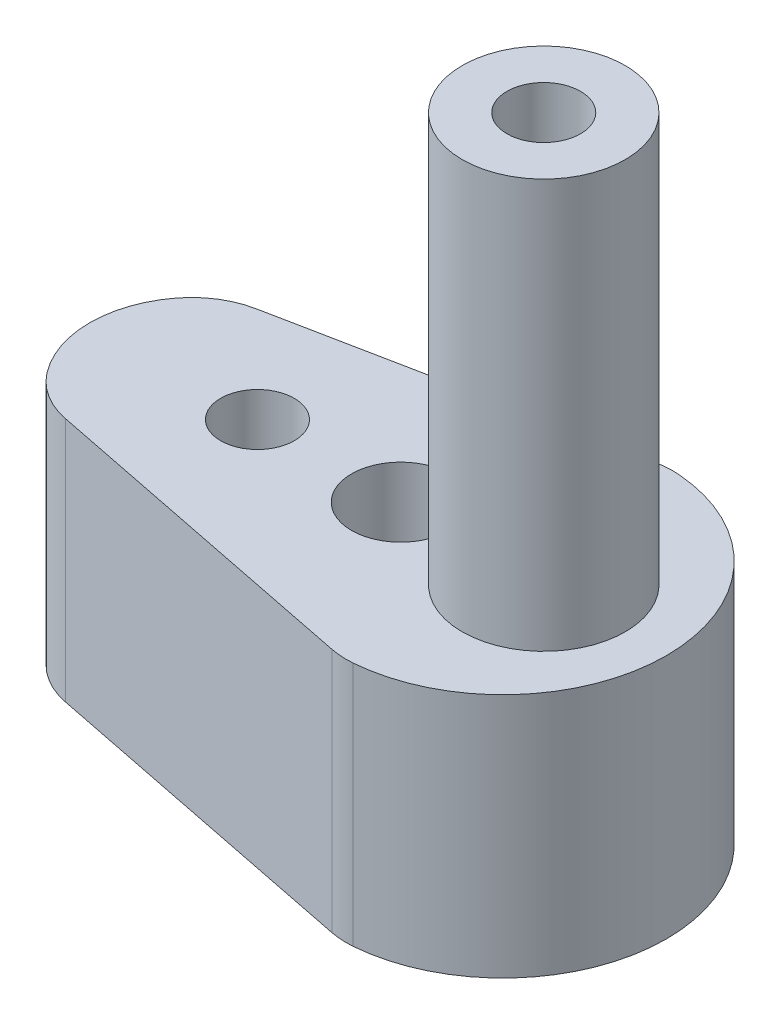
from build123d import *

# Parameters (mm, degrees)
SKETCH1_R           = 0.45
SKETCH1_R_2         = 0.6
BOSS_EXTRUDE1_DEPTH = 3
SKETCH1_22_R        = 0.996628177
SKETCH1_22_R_2      = 0.45
BOSS_EXTRUDE2_DEPTH = 8


with BuildPart() as part:
    # Sketch1 → Boss-Extrude1 (new body)
    with BuildSketch(Plane(origin=(0, 0, 0), x_dir=(1, 0, 0), z_dir=(0, 1, 0))):
        with BuildLine():
            ThreePointArc((0.1641009, 1.993256355), (0.024548565, 1.994973575), (-0.113883759, 1.977245221))
            Line((-0.113883759, 1.977245221), (-4.183235691, 1.164159973))
            ThreePointArc((-4.183235691, 1.164159973), (-4.514100231, 1.033532975), (-4.77830642, 0.795352694))
            ThreePointArc((-4.77830642, 0.795352694), (-5.05, 0), (-4.77830642, -0.795352694))
            ThreePointArc((-4.77830642, -0.795352694), (-4.514100231, -1.033532975), (-4.183235691, -1.164159973))
            Line((-4.183235691, -1.164159973), (-0.11388376, -1.977245221))
            ThreePointArc((-0.11388376, -1.977245221), (0.024548564, -1.994973575), (0.164100898, -1.993256355))
            ThreePointArc((0.164100898, -1.993256355), (2, -1e-09), (0.1641009, 1.993256355))
        make_face()
        with Locations((-3, 0)):
            Circle(SKETCH1_R, mode=Mode.SUBTRACT)
        with Locations((-1.25, 0)):
            Circle(SKETCH1_R_2, mode=Mode.SUBTRACT)
        with Locations((0.5, 0)):
            Circle(SKETCH1_R, mode=Mode.SUBTRACT)
    extrude(amount=BOSS_EXTRUDE1_DEPTH)

    # Sketch1<22> → Boss-Extrude2 (add)
    with BuildSketch(Plane(origin=(0, 0, 0), x_dir=(1, 0, 0), z_dir=(0, 1, 0))):
        with Locations((0.5, 0)):
            Circle(SKETCH1_22_R)
        with Locations((0.5, 0)):
            Circle(SKETCH1_22_R_2, mode=Mode.SUBTRACT)
    extrude(amount=BOSS_EXTRUDE2_DEPTH)


solid = part.part
